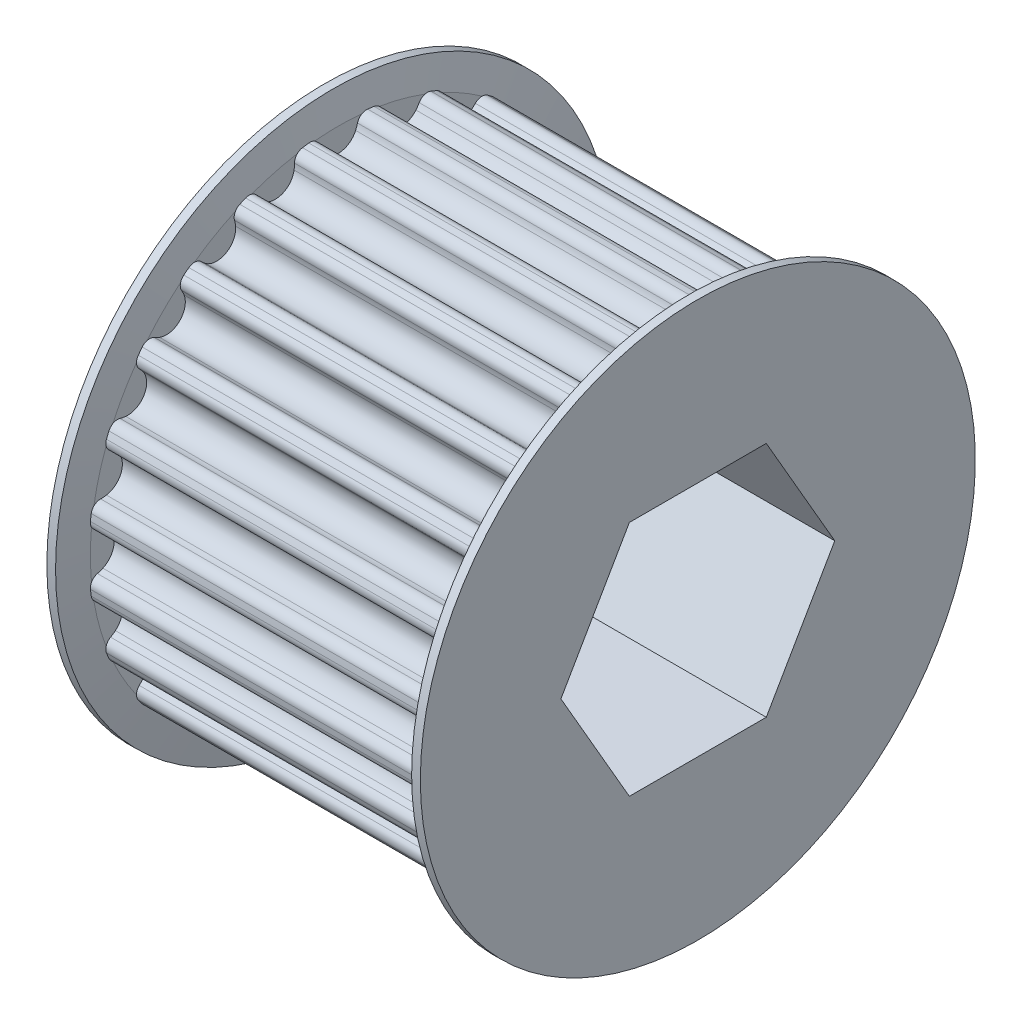
from build123d import *

# Parameters (mm, degrees)
BOSS_EXTRUDE1_DEPTH     = 9.254
CUT_EXTRUDE1_DEPTH      = 24.272658101
CUT_EXTRUDE1_DEPTH_BACK = 24.272658101


with BuildPart() as part:
    # Sketch1 → Boss-Extrude1 (new, symmetric)
    with BuildSketch(Plane(origin=(0, 0, 0), x_dir=(0, 0, -1), z_dir=(1, 0, 0))):
        with BuildLine():
            ThreePointArc((5.557566246, 11.685612776), (5.527526108, 12.036559437), (5.273565886, 12.280629458))
            ThreePointArc((5.273565886, 12.280629458), (5.114580281, 12.347689079), (4.954742168, 12.412690566))
            ThreePointArc((4.954742168, 12.412690566), (4.602581606, 12.419683994), (4.333183257, 12.192768815))
            ThreePointArc((4.333183257, 12.192768815), (4.251529891, 12.060664876), (4.158889512, 11.936019446))
            ThreePointArc((4.158889512, 11.936019446), (3.106847627, 11.594913197), (2.366305754, 12.416340816))
            ThreePointArc((2.366305754, 12.416340816), (2.348399548, 12.570607114), (2.343737628, 12.725839165))
            ThreePointArc((2.343737628, 12.725839165), (2.223889403, 13.057052649), (1.915412697, 13.227076444))
            ThreePointArc((1.915412697, 13.227076444), (1.744488087, 13.250702561), (1.573272703, 13.272120029))
            ThreePointArc((1.573272703, 13.272120029), (1.231301689, 13.187729301), (1.029812836, 12.898820645))
            ThreePointArc((1.029812836, 12.898820645), (0.985132756, 12.750084592), (0.927909633, 12.605709258))
            ThreePointArc((0.927909633, 12.605709258), (0, 12.003937447), (-0.927909633, 12.605709258))
            ThreePointArc((-0.927909633, 12.605709258), (-0.985132756, 12.750084592), (-1.029812836, 12.898820645))
            ThreePointArc((-1.029812836, 12.898820645), (-1.231301689, 13.187729301), (-1.573272703, 13.272120029))
            ThreePointArc((-1.573272703, 13.272120029), (-1.744488087, 13.250702561), (-1.915412697, 13.227076444))
            ThreePointArc((-1.915412697, 13.227076444), (-2.223889403, 13.057052649), (-2.343737628, 12.725839165))
            ThreePointArc((-2.343737628, 12.725839165), (-2.348399548, 12.570607114), (-2.366305754, 12.416340816))
            ThreePointArc((-2.366305754, 12.416340816), (-3.106847627, 11.594913197), (-4.158889512, 11.936019446))
            ThreePointArc((-4.158889512, 11.936019446), (-4.251529891, 12.060664876), (-4.333183257, 12.192768815))
            ThreePointArc((-4.333183257, 12.192768815), (-4.602581606, 12.419683994), (-4.954742168, 12.412690566))
            ThreePointArc((-4.954742168, 12.412690566), (-5.114580281, 12.347689079), (-5.273565886, 12.280629458))
            ThreePointArc((-5.273565886, 12.280629458), (-5.527526108, 12.036559437), (-5.557566246, 11.685612776))
            ThreePointArc((-5.557566246, 11.685612776), (-5.521892303, 11.534463536), (-5.499261314, 11.380819267))
            ThreePointArc((-5.499261314, 11.380819267), (-6.001968723, 10.395714774), (-7.106447944, 10.452909633))
            ThreePointArc((-7.106447944, 10.452909633), (-7.228192289, 10.549330779), (-7.341254399, 10.65579994))
            ThreePointArc((-7.341254399, 10.65579994), (-7.660203193, 10.805257748), (-7.998554142, 10.707356755))
            ThreePointArc((-7.998554142, 10.707356755), (-8.13612228, 10.603200992), (-8.272334276, 10.49727787))
            ThreePointArc((-8.272334276, 10.49727787), (-8.454471043, 10.195794591), (-8.392655908, 9.849031187))
            ThreePointArc((-8.392655908, 9.849031187), (-8.319077224, 9.712265328), (-8.257451304, 9.569713692))
            ThreePointArc((-8.257451304, 9.569713692), (-8.488065569, 8.488065569), (-9.569713692, 8.257451304))
            ThreePointArc((-9.569713692, 8.257451304), (-9.712265328, 8.319077224), (-9.849031187, 8.392655908))
            ThreePointArc((-9.849031187, 8.392655908), (-10.195794591, 8.454471043), (-10.49727787, 8.272334276))
            ThreePointArc((-10.49727787, 8.272334276), (-10.603200992, 8.13612228), (-10.707356755, 7.998554142))
            ThreePointArc((-10.707356755, 7.998554142), (-10.805257748, 7.660203193), (-10.65579994, 7.341254399))
            ThreePointArc((-10.65579994, 7.341254399), (-10.549330779, 7.228192289), (-10.452909633, 7.106447944))
            ThreePointArc((-10.452909633, 7.106447944), (-10.395714774, 6.001968723), (-11.380819267, 5.499261314))
            ThreePointArc((-11.380819267, 5.499261314), (-11.534463536, 5.521892303), (-11.685612776, 5.557566246))
            ThreePointArc((-11.685612776, 5.557566246), (-12.036559437, 5.527526108), (-12.280629458, 5.273565886))
            ThreePointArc((-12.280629458, 5.273565886), (-12.347689079, 5.114580281), (-12.412690566, 4.954742168))
            ThreePointArc((-12.412690566, 4.954742168), (-12.419683994, 4.602581606), (-12.192768815, 4.333183257))
            ThreePointArc((-12.192768815, 4.333183257), (-12.060664876, 4.251529891), (-11.936019446, 4.158889512))
            ThreePointArc((-11.936019446, 4.158889512), (-11.594913197, 3.106847627), (-12.416340816, 2.366305754))
            ThreePointArc((-12.416340816, 2.366305754), (-12.570607114, 2.348399548), (-12.725839165, 2.343737628))
            ThreePointArc((-12.725839165, 2.343737628), (-13.057052649, 2.223889403), (-13.227076444, 1.915412697))
            ThreePointArc((-13.227076444, 1.915412697), (-13.250702561, 1.744488087), (-13.272120029, 1.573272703))
            ThreePointArc((-13.272120029, 1.573272703), (-13.187729301, 1.231301689), (-12.898820645, 1.029812836))
            ThreePointArc((-12.898820645, 1.029812836), (-12.750084592, 0.985132756), (-12.605709258, 0.927909633))
            ThreePointArc((-12.605709258, 0.927909633), (-12.003937447, 0), (-12.605709258, -0.927909633))
            ThreePointArc((-12.605709258, -0.927909633), (-12.750084592, -0.985132756), (-12.898820645, -1.029812836))
            ThreePointArc((-12.898820645, -1.029812836), (-13.187729301, -1.231301689), (-13.272120029, -1.573272703))
            ThreePointArc((-13.272120029, -1.573272703), (-13.250702561, -1.744488087), (-13.227076444, -1.915412697))
            ThreePointArc((-13.227076444, -1.915412697), (-13.057052649, -2.223889403), (-12.725839165, -2.343737628))
            ThreePointArc((-12.725839165, -2.343737628), (-12.570607114, -2.348399548), (-12.416340816, -2.366305754))
            ThreePointArc((-12.416340816, -2.366305754), (-11.594913197, -3.106847627), (-11.936019446, -4.158889512))
            ThreePointArc((-11.936019446, -4.158889512), (-12.060664876, -4.251529891), (-12.192768815, -4.333183257))
            ThreePointArc((-12.192768815, -4.333183257), (-12.419683994, -4.602581606), (-12.412690566, -4.954742168))
            ThreePointArc((-12.412690566, -4.954742168), (-12.347689079, -5.114580281), (-12.280629458, -5.273565886))
            ThreePointArc((-12.280629458, -5.273565886), (-12.036559437, -5.527526108), (-11.685612776, -5.557566246))
            ThreePointArc((-11.685612776, -5.557566246), (-11.534463536, -5.521892303), (-11.380819267, -5.499261314))
            ThreePointArc((-11.380819267, -5.499261314), (-10.395714774, -6.001968723), (-10.452909633, -7.106447944))
            ThreePointArc((-10.452909633, -7.106447944), (-10.549330779, -7.228192289), (-10.65579994, -7.341254399))
            ThreePointArc((-10.65579994, -7.341254399), (-10.805257748, -7.660203193), (-10.707356755, -7.998554142))
            ThreePointArc((-10.707356755, -7.998554142), (-10.603200992, -8.13612228), (-10.49727787, -8.272334276))
            ThreePointArc((-10.49727787, -8.272334276), (-10.195794591, -8.454471043), (-9.849031187, -8.392655908))
            ThreePointArc((-9.849031187, -8.392655908), (-9.712265328, -8.319077224), (-9.569713692, -8.257451304))
            ThreePointArc((-9.569713692, -8.257451304), (-8.488065569, -8.488065569), (-8.257451304, -9.569713692))
            ThreePointArc((-8.257451304, -9.569713692), (-8.319077224, -9.712265328), (-8.392655908, -9.849031187))
            ThreePointArc((-8.392655908, -9.849031187), (-8.454471043, -10.195794591), (-8.272334276, -10.49727787))
            ThreePointArc((-8.272334276, -10.49727787), (-8.13612228, -10.603200992), (-7.998554142, -10.707356755))
            ThreePointArc((-7.998554142, -10.707356755), (-7.660203193, -10.805257748), (-7.341254399, -10.65579994))
            ThreePointArc((-7.341254399, -10.65579994), (-7.228192289, -10.549330779), (-7.106447944, -10.452909633))
            ThreePointArc((-7.106447944, -10.452909633), (-6.001968723, -10.395714774), (-5.499261314, -11.380819267))
            ThreePointArc((-5.499261314, -11.380819267), (-5.521892303, -11.534463536), (-5.557566246, -11.685612776))
            ThreePointArc((-5.557566246, -11.685612776), (-5.527526108, -12.036559437), (-5.273565886, -12.280629458))
            ThreePointArc((-5.273565886, -12.280629458), (-5.114580281, -12.347689079), (-4.954742168, -12.412690566))
            ThreePointArc((-4.954742168, -12.412690566), (-4.602581606, -12.419683994), (-4.333183257, -12.192768815))
            ThreePointArc((-4.333183257, -12.192768815), (-4.251529891, -12.060664876), (-4.158889512, -11.936019446))
            ThreePointArc((-4.158889512, -11.936019446), (-3.106847627, -11.594913197), (-2.366305754, -12.416340816))
            ThreePointArc((-2.366305754, -12.416340816), (-2.348399548, -12.570607114), (-2.343737628, -12.725839165))
            ThreePointArc((-2.343737628, -12.725839165), (-2.223889403, -13.057052649), (-1.915412697, -13.227076444))
            ThreePointArc((-1.915412697, -13.227076444), (-1.744488087, -13.250702561), (-1.573272703, -13.272120029))
            ThreePointArc((-1.573272703, -13.272120029), (-1.231301689, -13.187729301), (-1.029812836, -12.898820645))
            ThreePointArc((-1.029812836, -12.898820645), (-0.985132756, -12.750084592), (-0.927909633, -12.605709258))
            ThreePointArc((-0.927909633, -12.605709258), (0, -12.003937447), (0.927909633, -12.605709258))
            ThreePointArc((0.927909633, -12.605709258), (0.985132756, -12.750084592), (1.029812836, -12.898820645))
            ThreePointArc((1.029812836, -12.898820645), (1.231301689, -13.187729301), (1.573272703, -13.272120029))
            ThreePointArc((1.573272703, -13.272120029), (1.744488087, -13.250702561), (1.915412697, -13.227076444))
            ThreePointArc((1.915412697, -13.227076444), (2.223889403, -13.057052649), (2.343737628, -12.725839165))
            ThreePointArc((2.343737628, -12.725839165), (2.348399548, -12.570607114), (2.366305754, -12.416340816))
            ThreePointArc((2.366305754, -12.416340816), (3.106847627, -11.594913197), (4.158889512, -11.936019446))
            ThreePointArc((4.158889512, -11.936019446), (4.251529891, -12.060664876), (4.333183257, -12.192768815))
            ThreePointArc((4.333183257, -12.192768815), (4.602581606, -12.419683994), (4.954742168, -12.412690566))
            ThreePointArc((4.954742168, -12.412690566), (5.114580281, -12.347689079), (5.273565886, -12.280629458))
            ThreePointArc((5.273565886, -12.280629458), (5.527526108, -12.036559437), (5.557566246, -11.685612776))
            ThreePointArc((5.557566246, -11.685612776), (5.521892303, -11.534463536), (5.499261314, -11.380819267))
            ThreePointArc((5.499261314, -11.380819267), (6.001968723, -10.395714774), (7.106447944, -10.452909633))
            ThreePointArc((7.106447944, -10.452909633), (7.228192289, -10.549330779), (7.341254399, -10.65579994))
            ThreePointArc((7.341254399, -10.65579994), (7.660203193, -10.805257748), (7.998554142, -10.707356755))
            ThreePointArc((7.998554142, -10.707356755), (8.13612228, -10.603200992), (8.272334276, -10.49727787))
            ThreePointArc((8.272334276, -10.49727787), (8.454471043, -10.195794591), (8.392655908, -9.849031187))
            ThreePointArc((8.392655908, -9.849031187), (8.319077224, -9.712265328), (8.257451304, -9.569713692))
            ThreePointArc((8.257451304, -9.569713692), (8.488065569, -8.488065569), (9.569713692, -8.257451304))
            ThreePointArc((9.569713692, -8.257451304), (9.712265328, -8.319077224), (9.849031187, -8.392655908))
            ThreePointArc((9.849031187, -8.392655908), (10.195794591, -8.454471043), (10.49727787, -8.272334276))
            ThreePointArc((10.49727787, -8.272334276), (10.603200992, -8.13612228), (10.707356755, -7.998554142))
            ThreePointArc((10.707356755, -7.998554142), (10.805257748, -7.660203193), (10.65579994, -7.341254399))
            ThreePointArc((10.65579994, -7.341254399), (10.549330779, -7.228192289), (10.452909633, -7.106447944))
            ThreePointArc((10.452909633, -7.106447944), (10.395714774, -6.001968723), (11.380819267, -5.499261314))
            ThreePointArc((11.380819267, -5.499261314), (11.534463536, -5.521892303), (11.685612776, -5.557566246))
            ThreePointArc((11.685612776, -5.557566246), (12.036559437, -5.527526108), (12.280629458, -5.273565886))
            ThreePointArc((12.280629458, -5.273565886), (12.347689079, -5.114580281), (12.412690566, -4.954742168))
            ThreePointArc((12.412690566, -4.954742168), (12.419683994, -4.602581606), (12.192768815, -4.333183257))
            ThreePointArc((12.192768815, -4.333183257), (12.060664876, -4.251529891), (11.936019446, -4.158889512))
            ThreePointArc((11.936019446, -4.158889512), (11.594913197, -3.106847627), (12.416340816, -2.366305754))
            ThreePointArc((12.416340816, -2.366305754), (12.570607114, -2.348399548), (12.725839165, -2.343737628))
            ThreePointArc((12.725839165, -2.343737628), (13.057052649, -2.223889403), (13.227076444, -1.915412697))
            ThreePointArc((13.227076444, -1.915412697), (13.250702561, -1.744488087), (13.272120029, -1.573272703))
            ThreePointArc((13.272120029, -1.573272703), (13.187729301, -1.231301689), (12.898820645, -1.029812836))
            ThreePointArc((12.898820645, -1.029812836), (12.750084592, -0.985132756), (12.605709258, -0.927909633))
            ThreePointArc((12.605709258, -0.927909633), (12.003937447, 0), (12.605709258, 0.927909633))
            ThreePointArc((12.605709258, 0.927909633), (12.750084592, 0.985132756), (12.898820645, 1.029812836))
            ThreePointArc((12.898820645, 1.029812836), (13.187729301, 1.231301689), (13.272120029, 1.573272703))
            ThreePointArc((13.272120029, 1.573272703), (13.250702561, 1.744488087), (13.227076444, 1.915412697))
            ThreePointArc((13.227076444, 1.915412697), (13.057052649, 2.223889403), (12.725839165, 2.343737628))
            ThreePointArc((12.725839165, 2.343737628), (12.570607114, 2.348399548), (12.416340816, 2.366305754))
            ThreePointArc((12.416340816, 2.366305754), (11.594913197, 3.106847627), (11.936019446, 4.158889512))
            ThreePointArc((11.936019446, 4.158889512), (12.060664876, 4.251529891), (12.192768815, 4.333183257))
            ThreePointArc((12.192768815, 4.333183257), (12.419683994, 4.602581606), (12.412690566, 4.954742168))
            ThreePointArc((12.412690566, 4.954742168), (12.347689079, 5.114580281), (12.280629458, 5.273565886))
            ThreePointArc((12.280629458, 5.273565886), (12.036559437, 5.527526108), (11.685612776, 5.557566246))
            ThreePointArc((11.685612776, 5.557566246), (11.534463536, 5.521892303), (11.380819267, 5.499261314))
            ThreePointArc((11.380819267, 5.499261314), (10.395714774, 6.001968723), (10.452909633, 7.106447944))
            ThreePointArc((10.452909633, 7.106447944), (10.549330779, 7.228192289), (10.65579994, 7.341254399))
            ThreePointArc((10.65579994, 7.341254399), (10.805257748, 7.660203193), (10.707356755, 7.998554142))
            ThreePointArc((10.707356755, 7.998554142), (10.603200992, 8.13612228), (10.49727787, 8.272334276))
            ThreePointArc((10.49727787, 8.272334276), (10.195794591, 8.454471043), (9.849031187, 8.392655908))
            ThreePointArc((9.849031187, 8.392655908), (9.712265328, 8.319077224), (9.569713692, 8.257451304))
            ThreePointArc((9.569713692, 8.257451304), (8.488065569, 8.488065569), (8.257451304, 9.569713692))
            ThreePointArc((8.257451304, 9.569713692), (8.319077224, 9.712265328), (8.392655908, 9.849031187))
            ThreePointArc((8.392655908, 9.849031187), (8.454471043, 10.195794591), (8.272334276, 10.49727787))
            ThreePointArc((8.272334276, 10.49727787), (8.13612228, 10.603200992), (7.998554142, 10.707356755))
            ThreePointArc((7.998554142, 10.707356755), (7.660203193, 10.805257748), (7.341254399, 10.65579994))
            ThreePointArc((7.341254399, 10.65579994), (7.228192289, 10.549330779), (7.106447944, 10.452909633))
            ThreePointArc((7.106447944, 10.452909633), (6.001968723, 10.395714774), (5.499261314, 11.380819267))
            ThreePointArc((5.499261314, 11.380819267), (5.521892303, 11.534463536), (5.557566246, 11.685612776))
        make_face()
    extrude(amount=BOSS_EXTRUDE1_DEPTH, both=True)

    # Sketch2 → Revolve1 (revolve)
    with BuildSketch(Plane.XY, mode=Mode.PRIVATE) as revolve1_sk:
        Polygon((-10.000000016, 4.7625), (-9.254, 4.7625), (-9.254, 13.272120029), (-9.533919082, 14.859620029), (-10.000000016, 14.859620029), align=None)
        Polygon((10.000000016, 14.859620029), (10.000000016, 4.7625), (9.254, 4.7625), (9.254, 13.272120029), (9.533919082, 14.859620029), align=None)
    revolve(revolve1_sk.sketch.rotate(Axis((-8.335696951, 0, 0), (1, 0, 0)), 90), axis=Axis((-8.335696951, 0, 0), (1, 0, 0)))

    # Sketch3 → Cut-Extrude1 (cut, two sides: drawn at the far end of the back side and taken through both)
    with BuildSketch(Plane(origin=(0, 0, 0), x_dir=(0, 0, -1), z_dir=(1, 0, 0)).offset(-CUT_EXTRUDE1_DEPTH_BACK)):
        Polygon((7.332348419, 0), (3.666174209, 6.35), (-3.666174209, 6.35), (-7.332348419, 0), (-3.666174209, -6.35), (3.666174209, -6.35), align=None)
    extrude(amount=CUT_EXTRUDE1_DEPTH + CUT_EXTRUDE1_DEPTH_BACK, mode=Mode.SUBTRACT)


solid = part.part
